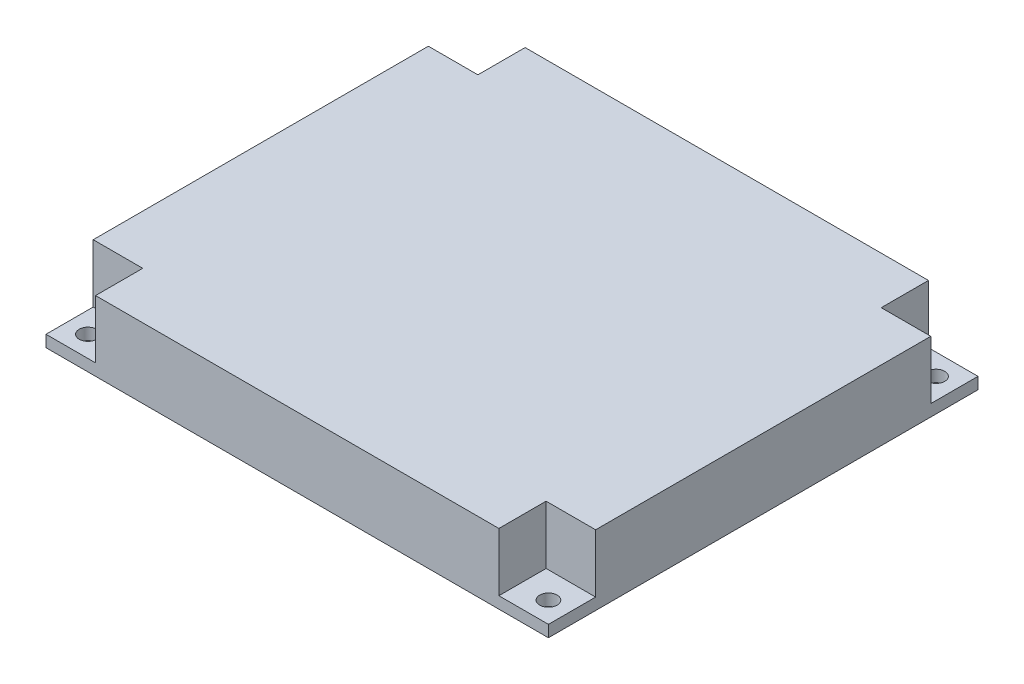
from build123d import *

# Parameters (mm, degrees)
SKETCH_1_W      = 86.2
SKETCH_1_H      = 73.7
SKETCH_1_R      = 1.5
EXTRUDE_1_DEPTH = 2
EXTRUDE_2_DEPTH = 10


with BuildPart() as part:
    # 草图1 → 凸台-拉伸1 (new body)
    with BuildSketch(Plane(origin=(0, 0, 0), x_dir=(1, 0, 0), z_dir=(0, 1, 0))):
        Rectangle(SKETCH_1_W, SKETCH_1_H)
        with Locations(Location((-39.5, 33.25, 0), (0, 0, 270))):
            Circle(SKETCH_1_R, mode=Mode.SUBTRACT)
        with Locations(Location((39.5, 33.25, 0), (0, 0, 270))):
            Circle(SKETCH_1_R, mode=Mode.SUBTRACT)
        with Locations(Location((-39.5, -33.25, 0), (0, 0, 270))):
            Circle(SKETCH_1_R, mode=Mode.SUBTRACT)
        with Locations(Location((39.5, -33.25, 0), (0, 0, 270))):
            Circle(SKETCH_1_R, mode=Mode.SUBTRACT)
    extrude(amount=EXTRUDE_1_DEPTH)

    # 草图2 → 凸台-拉伸2 (add)
    with BuildSketch(Plane(origin=(0, 2, 0), x_dir=(1, 0, 0), z_dir=(0, 1, 0))):
        Polygon((-34.6, 36.85), (34.6, 36.85), (34.6, 28.75), (43.1, 28.75), (43.1, -28.75), (34.6, -28.75), (34.6, -36.85), (-34.6, -36.85), (-34.6, -28.75), (-43.1, -28.75), (-43.1, 28.75), (-34.6, 28.75), align=None)
    extrude(amount=EXTRUDE_2_DEPTH)


solid = part.part
